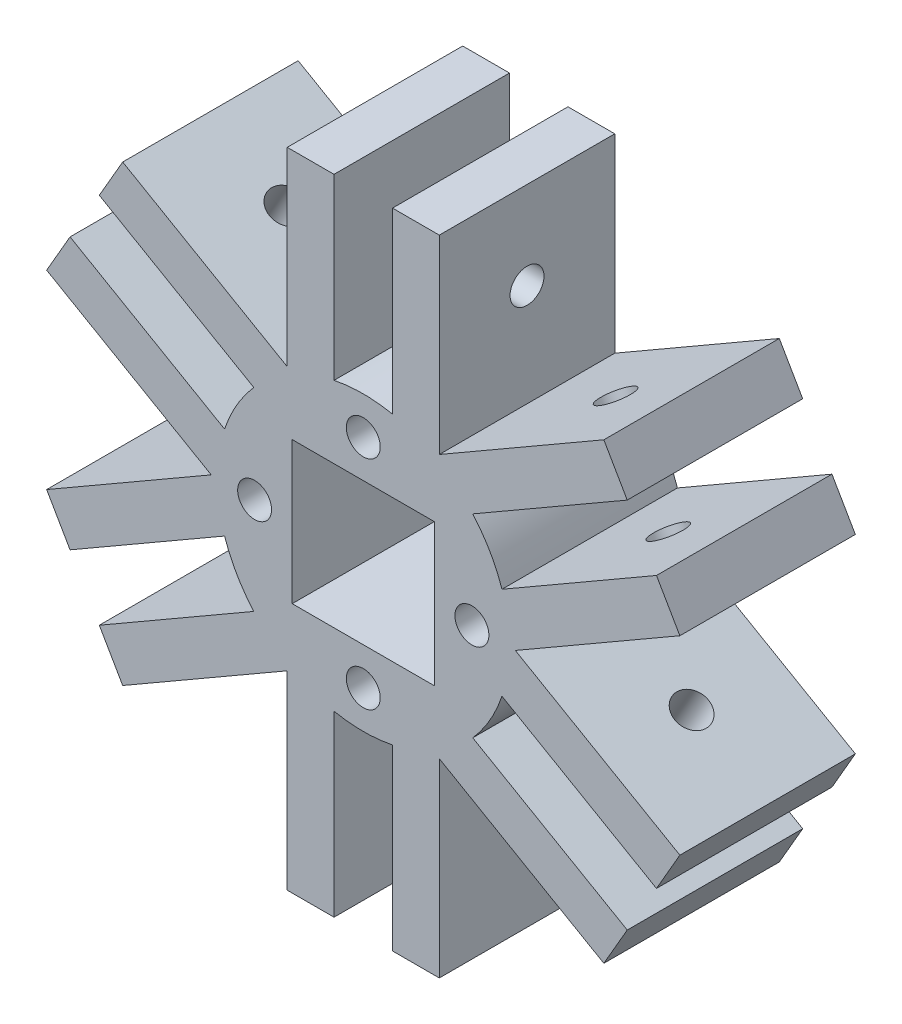
from build123d import *

# Parameters (mm, degrees)
SKETCH1_R           = 12.5
BOSS_EXTRUDE1_DEPTH = 7.5
SKETCH4_W           = 4
SKETCH4_H           = 27.5
BOSS_EXTRUDE3_DEPTH = 15
CIRPATTERN7_COUNT   = 6
SKETCH7_R           = 1.45
CUT_EXTRUDE2_DEPTH  = 17
CIRPATTERN9_COUNT   = 6
CUT_EXTRUDE3_REACH  = 43.398
SKETCH8_W           = 12.15
SKETCH8_H           = 12.15
SKETCH9_R           = 1.45
CUT_EXTRUDE4_DEPTH  = 10


with BuildPart() as part:
    # Sketch1 → Boss-Extrude1 (new, symmetric)
    with BuildSketch(Plane.XY):
        Circle(SKETCH1_R)
    extrude(amount=BOSS_EXTRUDE1_DEPTH, both=True)

    # Sketch4 → Boss-Extrude3 (add)
    with BuildSketch(Plane.XY.offset(7.5)):
        with Locations((-4.5, 13.75)):
            Rectangle(SKETCH4_W, SKETCH4_H)
        with Locations((4.5, 13.75)):
            Rectangle(SKETCH4_W, SKETCH4_H)
    boss_extrude3 = extrude(amount=-BOSS_EXTRUDE3_DEPTH)

    # CirPattern7: Boss-Extrude3 ×6 about axis
    cirpattern7_axis = Axis((0, 0, 0), (0, 0, 1))
    for i in range(1, CIRPATTERN7_COUNT):
        add(boss_extrude3.rotate(cirpattern7_axis, i * 360 / CIRPATTERN7_COUNT))

    # Sketch7 → Cut-Extrude2 (cut)
    with BuildSketch(Plane.ZY.offset(6.5)):
        with Locations((0, 20)):
            Circle(SKETCH7_R)
        with Locations((40, 20)):
            Circle(SKETCH7_R)
        with Locations((80, 20)):
            Circle(SKETCH7_R)
        with Locations((120, 20)):
            Circle(SKETCH7_R)
        with Locations((160, 20)):
            Circle(SKETCH7_R)
    cut_extrude2 = extrude(amount=-CUT_EXTRUDE2_DEPTH, mode=Mode.SUBTRACT)

    # CirPattern9: Cut-Extrude2 ×6 about axis
    cirpattern9_axis = Axis((0, 0, 0), (0, 0, 1))
    for i in range(1, CIRPATTERN9_COUNT):
        add(cut_extrude2.rotate(cirpattern9_axis, i * 360 / CIRPATTERN9_COUNT), mode=Mode.SUBTRACT)

    # Sketch8 → Cut-Extrude3 (cut, up to next)
    with BuildSketch(Plane.XY.offset(7.5), mode=Mode.PRIVATE) as cut_extrude3_sk1:
        Rectangle(SKETCH8_W, SKETCH8_H)
    cut_extrude3_tool1 = extrude(cut_extrude3_sk1.sketch, amount=-CUT_EXTRUDE3_REACH, mode=Mode.PRIVATE) & part.part
    add(cut_extrude3_tool1.solids().sort_by_distance((0, 0, 7.5))[0], mode=Mode.SUBTRACT)

    # Sketch9 → Cut-Extrude4 (cut)
    with BuildSketch(Plane.XY.offset(7.5)):
        with Locations((9.2875, 0)):
            Circle(SKETCH9_R)
        with Locations((0, -9.2875)):
            Circle(SKETCH9_R)
        with Locations((-9.2875, 0)):
            Circle(SKETCH9_R)
        with Locations((0, 9.2875)):
            Circle(SKETCH9_R)
    extrude(amount=-CUT_EXTRUDE4_DEPTH, mode=Mode.SUBTRACT)


solid = part.part
